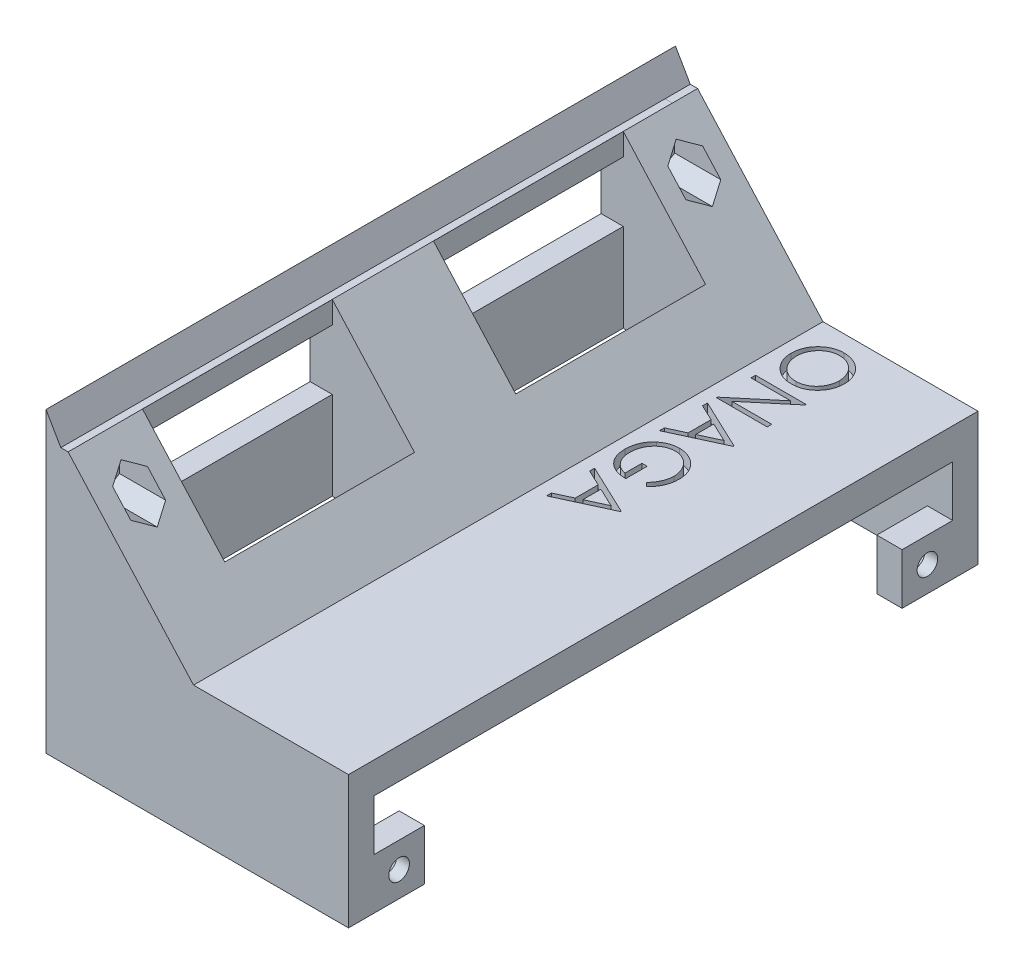
from build123d import *

# Parameters (mm, degrees)
SALIENTE_EXTRUIR3_DEPTH  = 4
SALIENTE_EXTRUIR5_DEPTH  = 91.5
SALIENTE_EXTRUIR6_DEPTH  = 4
SALIENTE_EXTRUIR7_DEPTH  = 7.75
SALIENTE_EXTRUIR8_DEPTH  = 7.75
SALIENTE_EXTRUIR9_DEPTH  = 76
CROQUIS9_W               = 16
CROQUIS9_H               = 11.933903627
SALIENTE_EXTRUIR10_DEPTH = 13
CROQUIS12_W              = 13
CROQUIS12_H              = 16
SALIENTE_EXTRUIR12_DEPTH = 15.007372
CORTAR_EXTRUIR2_START    = 30
CORTAR_EXTRUIR2_DEPTH    = 16
CORTAR_EXTRUIR3_DEPTH    = 22
CORTAR_EXTRUIR4_DEPTH    = 12
CORTAR_EXTRUIR5_DEPTH    = 12
CROQUIS19_R              = 1.625
SALIENTE_EXTRUIR13_DEPTH = 3
CROQUIS20_W              = 30
CROQUIS20_H              = 9.5
CORTAR_EXTRUIR6_DEPTH    = 3.5
CROQUIS23_W              = 7.5
CROQUIS23_H              = 7.75
CROQUIS23_W_2            = 7.2
CROQUIS23_H_2            = 16
SALIENTE_EXTRUIR14_DEPTH = 6.575989
CORTAR_EXTRUIR7_DEPTH    = 7.2
CROQUIS25_R              = 1.6
CORTAR_EXTRUIR8_DEPTH    = 3
CROQUIS28_W              = 8
CROQUIS28_H              = 8
CROQUIS28_R              = 1.625
SALIENTE_EXTRUIR15_DEPTH = 3
CORTAR_EXTRUIR9_DEPTH    = 2
CORTAR_EXTRUIR10_START   = -3
CORTAR_EXTRUIR10_DEPTH   = 3
CORTAR_EXTRUIR11_DEPTH   = 2
SALIENTE_EXTRUIR17_START = -4
CROQUIS33_W              = 8
CROQUIS33_H              = 8.032777932
CROQUIS33_R              = 1.625
SALIENTE_EXTRUIR17_DEPTH = 4
CORTAR_EXTRUIR12_DEPTH   = 2
CROQUIS35_W              = 8
CROQUIS35_H              = 10.1
CROQUIS35_H_2            = 10.114110211
CORTAR_EXTRUIR13_DEPTH   = 2


with BuildPart() as part:
    # Croquis1 → Saliente-Extruir3 (new body)
    with BuildSketch(Plane.XY):
        Polygon((2, 89.065555864), (2, 42), (49.818734343, 42), (49.818734343, 57.993901803), (49.818734343, 62.993901803), (25.316882713, 62.993901803), (5.497094433, 85.006831044), (4.341572012, 85.006831044), align=None)
    extrude(amount=-SALIENTE_EXTRUIR3_DEPTH)

    # Croquis4 → Saliente-Extruir5 (add)
    with BuildSketch(Plane(origin=(0, 0, -4), x_dir=(-1, 0, 0), z_dir=(0, 0, -1))):
        Polygon((-5.497094433, 85.006831044), (-4.341572012, 85.006831044), (-2, 89.065555864), (-2, 58.065555864), (-5.5, 58.065555864), (-5.5, 85.003603965), align=None)
    extrude(amount=SALIENTE_EXTRUIR5_DEPTH)

    # Croquis5 → Saliente-Extruir6 (add)
    with BuildSketch(Plane(origin=(0, 0, -95.5), x_dir=(-1, 0, 0), z_dir=(0, 0, -1))):
        Polygon((-49.818734343, 42), (-49.818734343, 62.993901803), (-25.316882713, 62.993901803), (-5.5, 85.003603965), (-4.341572012, 85.006831044), (-2, 89.065555864), (-2, 42), align=None)
    extrude(amount=SALIENTE_EXTRUIR6_DEPTH)

    # Croquis6 → Saliente-Extruir7 (add)
    with BuildSketch(Plane(origin=(0, 0, -4), x_dir=(-1, 0, 0), z_dir=(0, 0, -1))):
        Polygon((-5.5, 85.003603965), (-25.316882713, 62.993901803), (-49.818734343, 62.993901803), (-49.818734343, 58.065555864), (-5.5, 58.065555864), align=None)
    extrude(amount=SALIENTE_EXTRUIR7_DEPTH)

    # Croquis7 → Saliente-Extruir8 (add)
    with BuildSketch(Plane.XY.offset(-95.5)):
        Polygon((5.497094433, 85.006831044), (25.316882713, 62.993901803), (49.818734343, 62.993901803), (49.818734343, 58.065555864), (5.5, 58.065555864), align=None)
    extrude(amount=SALIENTE_EXTRUIR8_DEPTH)

    # Croquis8 → Saliente-Extruir9 (add)
    with BuildSketch(Plane.XY.offset(-87.75)):
        Polygon((18.5, 58.065555864), (18.5, 70.565100581), (25.316882713, 62.993901803), (49.818734343, 62.993901803), (49.818734343, 58.065555864), align=None)
    extrude(amount=SALIENTE_EXTRUIR9_DEPTH)

    # Croquis9 → Saliente-Extruir10 (add)
    with BuildSketch(Plane.ZY.offset(-18.5)):
        with Locations((-49.75, 64.032507678)):
            Rectangle(CROQUIS9_W, CROQUIS9_H)
    extrude(amount=SALIENTE_EXTRUIR10_DEPTH)

    # Croquis12 → Saliente-Extruir12 (add)
    with BuildSketch(Plane(origin=(0, 69.999459491, 0), x_dir=(1, 0, 0), z_dir=(0, 1, 0))):
        with Locations((12, 49.75)):
            Rectangle(CROQUIS12_W, CROQUIS12_H)
    extrude(amount=SALIENTE_EXTRUIR12_DEPTH)

    # Croquis13 → Cortar-Extruir2 (cut)
    with BuildSketch(Plane.XY.offset(-87.75).offset(CORTAR_EXTRUIR2_START)):
        Polygon((5.497094433, 85.006831044), (18.5, 70.565100581), (18.5, 85.006831044), align=None)
    extrude(amount=CORTAR_EXTRUIR2_DEPTH, mode=Mode.SUBTRACT)

    # Croquis14 → Cortar-Extruir3 (cut)
    with BuildSketch(Plane.XZ.offset(-58.065555864)):
        Polygon((2, -49.75), (2, -43.75), (8, -43.75), (8, -55.75), (2, -55.75), align=None)
    extrude(amount=-CORTAR_EXTRUIR3_DEPTH, mode=Mode.SUBTRACT)

    # Croquis15 → Cortar-Extruir4 (cut)
    with BuildSketch(Plane(origin=(0, 0, -43.75), x_dir=(-1, 0, 0), z_dir=(0, 0, -1))):
        Polygon((-8, 80.065555864), (-2, 80.065555864), (-2, 86.714478443), align=None)
    extrude(amount=CORTAR_EXTRUIR4_DEPTH, mode=Mode.SUBTRACT)

    # Croquis18 → Cortar-Extruir5 (cut)
    with BuildSketch(Plane.ZY.offset(-2)):
        Polygon((-93.625, 75.885555864), (-90.871039216, 77.475555864), (-90.871039216, 80.655555864), (-93.625, 82.245555864), (-96.378960784, 80.655555864), (-96.378960784, 77.475555864), align=None)
        Polygon((-5.875, 82.245555864), (-8.628960784, 80.655555864), (-8.628960784, 77.475555864), (-5.875, 75.885555864), (-3.121039216, 77.475555864), (-3.121039216, 80.655555864), align=None)
    extrude(amount=-CORTAR_EXTRUIR5_DEPTH, mode=Mode.SUBTRACT)

    # Croquis19 → Saliente-Extruir13 (add)
    # profile 1 of 2: a face of its own
    with BuildSketch(Plane.ZY.offset(-2)):
        Polygon((-93.625, 75.885555864), (-90.871039216, 77.475555864), (-90.871039216, 80.655555864), (-93.625, 82.245555864), (-96.378960784, 80.655555864), (-96.378960784, 77.475555864), align=None)
        with Locations((-93.625, 79.065555864)):
            Circle(CROQUIS19_R, mode=Mode.SUBTRACT)
    # profile 2 of 2: a face of its own
    with BuildSketch(Plane.ZY.offset(-2)):
        Polygon((-5.875, 75.885555864), (-3.121039216, 77.475555864), (-3.121039216, 80.655555864), (-5.875, 82.245555864), (-8.628960784, 80.655555864), (-8.628960784, 77.475555864), align=None)
        with Locations((-5.875, 79.065555864)):
            Circle(CROQUIS19_R, mode=Mode.SUBTRACT)
    extrude(amount=-SALIENTE_EXTRUIR13_DEPTH)

    # Croquis20 → Cortar-Extruir6 (cut)
    with BuildSketch(Plane(origin=(5.5, 0, 0), x_dir=(0, 0, -1), z_dir=(1, 0, 0))):
        with Locations((72.75, 76.753603965)):
            Rectangle(CROQUIS20_W, CROQUIS20_H)
        with Locations((26.75, 76.753603965)):
            Rectangle(CROQUIS20_W, CROQUIS20_H)
    extrude(amount=-CORTAR_EXTRUIR6_DEPTH, mode=Mode.SUBTRACT)

    # Croquis23 → Saliente-Extruir14 (add)
    with BuildSketch(Plane.XZ.offset(-58.065555864)):
        with Locations((11.45, -7.875)):
            Rectangle(CROQUIS23_W, CROQUIS23_H)
        with Locations((11.6, -49.75)):
            Rectangle(CROQUIS23_W_2, CROQUIS23_H_2)
        with Locations((11.45, -91.625)):
            Rectangle(CROQUIS23_W, CROQUIS23_H)
    extrude(amount=SALIENTE_EXTRUIR14_DEPTH)

    # Croquis24 → Cortar-Extruir7 (cut)
    with BuildSketch(Plane(origin=(15.2, 0, 0), x_dir=(0, 0, -1), z_dir=(1, 0, 0))):
        Polygon((8.979427919, 52.468994288), (8, 51.489566369), (11.75, 51.489566369), (11.75, 55.239566369), align=None)
        Polygon((41.75, 51.489566369), (41.75, 54.739566369), (45, 51.489566369), align=None)
        Polygon((56.18727418, 53.176840549), (54.5, 51.489566369), (57.75, 51.489566369), (57.75, 54.739566369), align=None)
        Polygon((89.03136291, 53.958203459), (91.5, 51.489566369), (87.75, 51.489566369), (87.75, 55.239566369), align=None)
    extrude(amount=-CORTAR_EXTRUIR7_DEPTH, mode=Mode.SUBTRACT)

    # Croquis25 → Cortar-Extruir8 (cut)
    with BuildSketch(Plane.XZ.offset(-51.489566369)):
        with Locations(Location((11.45, -54.5, 0), (0, 0, 270))):
            Circle(CROQUIS25_R)
        with Locations(Location((11.45, -45, 0), (0, 0, 270))):
            Circle(CROQUIS25_R)
        with Locations(Location((11.45, -8, 0), (0, 0, 270))):
            Circle(CROQUIS25_R)
        with Locations(Location((11.45, -91.5, 0), (0, 0, 270))):
            Circle(CROQUIS25_R)
    extrude(amount=-CORTAR_EXTRUIR8_DEPTH, mode=Mode.SUBTRACT)

    # Croquis28 → Saliente-Extruir15 (add)
    # profile 1 of 2: a face of its own
    with BuildSketch(Plane.ZY.offset(-2)):
        with Locations((-91.5, 46)):
            Rectangle(CROQUIS28_W, CROQUIS28_H)
        with Locations((-91.5, 46)):
            Circle(CROQUIS28_R, mode=Mode.SUBTRACT)
    # profile 2 of 2: a face of its own
    with BuildSketch(Plane.ZY.offset(-2)):
        with Locations((-8, 46)):
            Rectangle(CROQUIS28_W, CROQUIS28_H)
        with Locations((-8, 46)):
            Circle(CROQUIS28_R, mode=Mode.SUBTRACT)
    extrude(amount=-SALIENTE_EXTRUIR15_DEPTH)

    # Croquis29 → Cortar-Extruir9 (cut)
    with BuildSketch(Plane(origin=(5, 0, 0), x_dir=(0, 0, -1), z_dir=(1, 0, 0))):
        Polygon((11.17, 46), (9.585, 48.74530053), (6.415, 48.74530053), (4.83, 46), (6.415, 43.25469947), (9.585, 43.25469947), align=None)
        Polygon((94.68, 46), (93.09, 48.753960784), (89.91, 48.753960784), (88.32, 46), (89.91, 43.246039216), (93.09, 43.246039216), align=None)
    extrude(amount=-CORTAR_EXTRUIR9_DEPTH, mode=Mode.SUBTRACT)

    # Croquis30 → Cortar-Extruir10 (cut)
    with BuildSketch(Plane(origin=(5, 0, 0), x_dir=(0, 0, -1), z_dir=(1, 0, 0)).offset(CORTAR_EXTRUIR10_START)):
        Polygon((12, 50), (12, 49), (11, 50), align=None)
        Polygon((87.5, 50), (87.5, 49), (88.5, 50), align=None)
    extrude(amount=CORTAR_EXTRUIR10_DEPTH, mode=Mode.SUBTRACT)

    # Croquis31 → Cortar-Extruir11 (cut)
    # profile 1 of 5: a face of its own
    with BuildSketch(Plane(origin=(0, 62.993901803, 0), x_dir=(1, 0, 0), z_dir=(0, 1, 0))):
        with BuildLine():
            add(Edge.make_bspline(
                [(35.522010918, 92.730769231), (35.518258931, 92.582636447), (35.510889719, 92.291691438), (35.454480825, 91.864091249), (35.356889582, 91.455875439), (35.226923544, 91.063709462), (35.053518109, 90.692317849), (34.844041957, 90.338779161), (34.595515846, 90.004092985), (34.312109928, 89.691327124), (34.00262871, 89.406167399), (33.671404365, 89.157025312), (33.322972491, 88.946377559), (32.95612064, 88.773724366), (32.572463455, 88.638153823), (32.169819533, 88.544632996), (31.750834508, 88.484886354), (31.465058584, 88.477902036), (31.320087841, 88.474358974)],
                knots=[0, 0, 0, 0, 1.06508495, 2.091914715, 3.094501328, 4.079693967, 5.057647778, 6.035986298, 7.030177474, 8.050107388, 9.066943579, 10.051896531, 11.025616101, 11.9896488, 12.96281505, 13.945825876, 14.957941789, 16, 16, 16, 16], degree=3))
            add(Edge.make_bspline(
                [(31.320087841, 88.474358974), (31.176184982, 88.477901511), (30.892535777, 88.48488426), (30.476209684, 88.544700996), (30.075995845, 88.638500231), (29.692601226, 88.772466778), (29.325477225, 88.944290545), (28.976404899, 89.156361969), (28.642887123, 89.403854575), (28.331903515, 89.688028671), (28.046183597, 89.997436085), (27.79665416, 90.32959446), (27.583412832, 90.677683424), (27.411943853, 91.044313507), (27.275413843, 91.42539739), (27.182240104, 91.824427692), (27.12216221, 92.239623905), (27.115261811, 92.522757064), (27.111754508, 92.666666667)],
                knots=[0, 0, 0, 0, 1.04355943, 2.056976533, 3.044937463, 4.02179873, 4.997890911, 5.980248884, 6.980147982, 8.006253959, 9.032111064, 10.031228745, 11.015595249, 11.988180414, 12.962670953, 13.946861971, 14.95644057, 16, 16, 16, 16], degree=3))
            add(Edge.make_bspline(
                [(27.111754508, 92.666666667), (27.115295488, 92.811636822), (27.122275703, 93.097411589), (27.182125729, 93.516920748), (27.275680862, 93.919856211), (27.409508134, 94.304977344), (27.581813056, 94.67241053), (27.793550217, 95.022120231), (28.043053381, 95.354526679), (28.326849135, 95.666247253), (28.636405248, 95.951117719), (28.96638033, 96.201677743), (29.313636128, 96.412194194), (29.67674119, 96.584571853), (30.054756951, 96.720916019), (30.450061271, 96.81396422), (30.860439044, 96.874158344), (31.139851141, 96.881095457), (31.281626303, 96.884615385)],
                knots=[0, 0, 0, 0, 1.053167129, 2.076072758, 3.073341244, 4.055601477, 5.033424535, 6.017524495, 7.021518915, 8.049444456, 9.077120685, 10.074910483, 11.055688766, 12.022980584, 12.991883888, 13.970269434, 14.970104079, 16, 16, 16, 16], degree=3))
            add(Edge.make_bspline(
                [(31.281626303, 96.884615385), (31.376787124, 96.883394481), (31.565908271, 96.880968077), (31.846739815, 96.851713435), (32.123085302, 96.809348482), (32.394015792, 96.74831527), (32.659575527, 96.669587604), (32.919221423, 96.572569112), (33.1750922, 96.461385882), (33.422318182, 96.329006889), (33.661287408, 96.184577446), (33.889011767, 96.02709165), (34.101423487, 95.855451436), (34.301935684, 95.672108645), (34.48712607, 95.474525401), (34.661032222, 95.265675327), (34.821853929, 95.044465623), (34.96621349, 94.810546442), (35.098809501, 94.569881641), (35.209516259, 94.320725186), (35.307366186, 94.068334027), (35.385127862, 93.810485004), (35.447011067, 93.547774564), (35.489059141, 93.279874291), (35.518378785, 93.007060118), (35.520794998, 92.823262439), (35.522010918, 92.730769231)],
                knots=[0, 0, 0, 0, 1.037115869, 2.061148057, 3.07517727, 4.084041727, 5.086514338, 6.092668487, 7.104487461, 8.125783165, 9.147610153, 10.147694368, 11.141876323, 12.122903372, 13.107606018, 14.091946891, 15.084523921, 16.086505767, 17.087268121, 18.077809654, 19.05670789, 20.036870126, 21.011670792, 21.99694167, 22.991993299, 24, 24, 24, 24], degree=3))
        make_face()
        with BuildLine():
            add(Edge.make_bspline(
                [(34.701498098, 92.695512821), (34.700573075, 92.771432156), (34.698731872, 92.922545034), (34.674460866, 93.14719284), (34.639902789, 93.368898336), (34.59048209, 93.587649457), (34.52376594, 93.80226902), (34.445155188, 94.014900292), (34.352681552, 94.224522292), (34.24485499, 94.428791596), (34.127066181, 94.627366767), (33.99778888, 94.816029701), (33.857649947, 94.992898358), (33.708500522, 95.158539312), (33.548823069, 95.312469888), (33.381166052, 95.457810362), (33.200703051, 95.588711181), (33.012336822, 95.708678506), (32.816310239, 95.816033491), (32.614687727, 95.91149718), (32.405824435, 95.989586337), (32.191986362, 96.05327177), (31.973512168, 96.106071338), (31.748744514, 96.139520307), (31.518812829, 96.164051414), (31.363425734, 96.165788204), (31.284831431, 96.166666667)],
                knots=[0, 0, 0, 0, 1.008585988, 2.007529826, 2.999688727, 3.990042337, 4.984966365, 5.984641633, 7.001812546, 8.027570247, 9.052811818, 10.068991095, 11.064725446, 12.050001529, 13.029093193, 14.010961114, 14.996492974, 15.989185205, 16.977398719, 17.96520407, 18.951579521, 19.937648295, 20.929603947, 21.935788061, 22.955928099, 24, 24, 24, 24], degree=3))
            add(Edge.make_bspline(
                [(31.284831431, 96.166666667), (31.16926064, 96.163752696), (30.941897143, 96.158020016), (30.608712814, 96.107831284), (30.288511016, 96.030523914), (29.983043795, 95.916564219), (29.689685434, 95.774048528), (29.411038338, 95.597987065), (29.147027197, 95.389394869), (28.899495153, 95.152449666), (28.673561886, 94.893426336), (28.475245524, 94.618380096), (28.307450667, 94.330257565), (28.170753359, 94.028307387), (28.062433958, 93.714141584), (27.988197087, 93.385735753), (27.939338903, 93.04527756), (27.93464689, 92.813207491), (27.932267328, 92.695512821)],
                knots=[0, 0, 0, 0, 1.032063989, 2.030389145, 3.003944642, 3.970395727, 4.937377036, 5.913328081, 6.909231446, 7.93887556, 8.970685674, 9.976071282, 10.964166581, 11.944589148, 12.933237628, 13.927779006, 14.949070134, 16, 16, 16, 16], degree=3))
            add(Edge.make_bspline(
                [(27.932267328, 92.695512821), (27.933354192, 92.616405386), (27.93550977, 92.459511584), (27.957221078, 92.226150423), (27.992036603, 91.996993244), (28.042164467, 91.772362205), (28.104898531, 91.552509512), (28.179439448, 91.336527704), (28.272391289, 91.126679266), (28.375256838, 90.920460748), (28.491680754, 90.723032691), (28.619151016, 90.535721438), (28.756783719, 90.359612909), (28.904637951, 90.194325663), (29.06143917, 90.039328521), (29.231218993, 89.898830304), (29.40901907, 89.766361315), (29.597824664, 89.646874353), (29.79426433, 89.539732807), (29.996650563, 89.44656659), (30.204287831, 89.367478272), (30.417528051, 89.303644782), (30.635952216, 89.253620035), (30.859856566, 89.219151873), (31.08879216, 89.195041095), (31.243635265, 89.193223784), (31.321690405, 89.192307692)],
                knots=[0, 0, 0, 0, 1.047226202, 2.076964084, 3.100341814, 4.114585567, 5.122123135, 6.126552355, 7.137064942, 8.158803602, 9.176592812, 10.169297945, 11.156925011, 12.133779169, 13.104132798, 14.073170763, 15.049307625, 16.038276215, 17.028988595, 18.010110019, 18.986169996, 19.968539974, 20.955178716, 21.950601663, 22.966915103, 24, 24, 24, 24], degree=3))
            add(Edge.make_bspline(
                [(31.321690405, 89.192307692), (31.399211558, 89.193224522), (31.552989044, 89.195043222), (31.780328057, 89.219140307), (32.002621112, 89.253656628), (32.218995519, 89.303399961), (32.429506433, 89.367514598), (32.633956142, 89.446571353), (32.833106303, 89.539794895), (33.026464696, 89.646785122), (33.212006954, 89.767049861), (33.389383896, 89.898465275), (33.555264453, 90.043300355), (33.713743732, 90.197416989), (33.861441848, 90.364664703), (33.998407294, 90.544286038), (34.127947411, 90.734099813), (34.244801223, 90.935077672), (34.352736749, 91.142487478), (34.445132543, 91.355337596), (34.524105919, 91.571589651), (34.590209008, 91.790136444), (34.639951207, 92.012517547), (34.674448467, 92.237437942), (34.698734471, 92.465282076), (34.700573965, 92.618525706), (34.701498098, 92.695512821)],
                knots=[0, 0, 0, 0, 1.029967493, 2.04313025, 3.035375922, 4.01889446, 4.991458755, 5.958017022, 6.930036849, 7.912118993, 8.892942568, 9.867138445, 10.843712051, 11.817804417, 12.803729339, 13.806387533, 14.818654169, 15.856205545, 16.894655496, 17.924916651, 18.938004761, 19.953404357, 20.957695443, 21.963967554, 22.97713031, 24, 24, 24, 24], degree=3))
        make_face(mode=Mode.SUBTRACT)
    # profile 2 of 5: a face of its own
    with BuildSketch(Plane(origin=(0, 62.993901803, 0), x_dir=(1, 0, 0), z_dir=(0, 1, 0))):
        Polygon((27.316882713, 86.833333333), (35.316882713, 86.833333333), (35.316882713, 86.682692308), (29.020408354, 81.397435897), (35.316882713, 81.397435897), (35.316882713, 80.679487179), (27.316882713, 80.679487179), (27.316882713, 80.842948718), (33.598933995, 86.115384615), (27.316882713, 86.115384615), align=None)
    # profile 3 of 5: a face of its own
    with BuildSketch(Plane(origin=(0, 62.993901803, 0), x_dir=(1, 0, 0), z_dir=(0, 1, 0))):
        Polygon((35.316882713, 75.346153846), (27.316882713, 71.653846154), (27.316882713, 72.434294872), (29.880985277, 73.616987179), (29.880985277, 77.243589744), (27.316882713, 78.459935897), (27.316882713, 79.243589744), (35.316882713, 75.448717949), align=None)
        Polygon((33.757587841, 75.405448718), (30.701498098, 76.854166667), (30.701498098, 73.995192308), align=None, mode=Mode.SUBTRACT)
    # profile 4 of 5: a face of its own
    with BuildSketch(Plane(origin=(0, 62.993901803, 0), x_dir=(1, 0, 0), z_dir=(0, 1, 0))):
        with BuildLine():
            Line((33.951498098, 62.935897436), (33.368164764, 63.551282051))
            add(Edge.make_bspline(
                [(33.368164764, 63.551282051), (33.472741955, 63.66331396), (33.678847459, 63.884111564), (33.949676934, 64.241749796), (34.17761011, 64.616900006), (34.366295338, 65.003982375), (34.515482261, 65.396086931), (34.621125317, 65.786924462), (34.689545223, 66.172275248), (34.697547052, 66.428146278), (34.701498098, 66.554487179)],
                knots=[0, 0, 0, 0, 1.09204548, 2.152253107, 3.191356492, 4.216655925, 5.218178745, 6.177092199, 7.099906635, 8, 8, 8, 8], degree=3))
            add(Edge.make_bspline(
                [(34.701498098, 66.554487179), (34.700551316, 66.632006059), (34.69866021, 66.786842768), (34.674579925, 67.016842258), (34.639839375, 67.244398834), (34.590090578, 67.468727772), (34.525475301, 67.690720975), (34.447462, 67.90988461), (34.35355059, 68.12579563), (34.246483124, 68.337318405), (34.129600861, 68.543427397), (33.99924439, 68.737276422), (33.859416796, 68.91966248), (33.70831517, 69.089337429), (33.548341029, 69.248471441), (33.377317683, 69.394996916), (33.196486471, 69.529648789), (33.005864093, 69.650875395), (32.809783763, 69.75911537), (32.610034041, 69.854857641), (32.406823117, 69.934446175), (32.201328015, 70.000492582), (31.993120279, 70.052235265), (31.78219446, 70.089253789), (31.567830587, 70.109976412), (31.424295995, 70.113575369), (31.352139123, 70.115384615)],
                knots=[0, 0, 0, 0, 1.028345126, 2.054023193, 3.065714254, 4.082262095, 5.100859654, 6.132352297, 7.167492809, 8.223256921, 9.277568108, 10.309840045, 11.320860232, 12.32524711, 13.322830633, 14.313234294, 15.3114222, 16.312425732, 17.308799391, 18.282312954, 19.249923241, 20.202773571, 21.145015718, 22.094907699, 23.042283124, 24, 24, 24, 24], degree=3))
            add(Edge.make_bspline(
                [(31.352139123, 70.115384615), (31.278381374, 70.113641867), (31.131067282, 70.11016113), (30.911133618, 70.08831025), (30.694888037, 70.046485865), (30.479924798, 69.994964628), (30.269028776, 69.923207847), (30.059838333, 69.838602984), (29.854267258, 69.737182759), (29.653566211, 69.620137134), (29.458090643, 69.491693516), (29.273953093, 69.347828418), (29.098710574, 69.195002947), (28.936251578, 69.027657232), (28.782231273, 68.851155329), (28.640892929, 68.660224437), (28.509514135, 68.458618806), (28.389750662, 68.246030895), (28.282759723, 68.024767392), (28.187619389, 67.797894814), (28.109266618, 67.564688378), (28.045408095, 67.326373659), (27.993064558, 67.083234752), (27.959390317, 66.834037489), (27.934954133, 66.580614155), (27.933167458, 66.409782996), (27.932267328, 66.323717949)],
                knots=[0, 0, 0, 0, 0.935842715, 1.869129955, 2.799583258, 3.728257868, 4.6712142, 5.62263184, 6.589468525, 7.576334199, 8.568768874, 9.554260682, 10.538610026, 11.516240982, 12.510802173, 13.508383516, 14.52719334, 15.561971611, 16.601598616, 17.64369662, 18.68095744, 19.719943675, 20.77263142, 21.833597991, 22.908562741, 24, 24, 24, 24], degree=3))
            add(Edge.make_bspline(
                [(27.932267328, 66.323717949), (27.934435502, 66.219996012), (27.938693065, 66.016321137), (27.971836587, 65.71692356), (28.023600673, 65.429373662), (28.099408486, 65.154479562), (28.196102421, 64.891921513), (28.312663966, 64.640738707), (28.453559925, 64.402902397), (28.612595115, 64.17772134), (28.789738145, 63.970222245), (28.981046875, 63.783321823), (29.184649549, 63.619039584), (29.402344509, 63.478742076), (29.630650651, 63.357876688), (29.873633658, 63.261491819), (30.12853864, 63.186935415), (30.304762627, 63.156436337), (30.39380579, 63.141025641)],
                knots=[0, 0, 0, 0, 1.13011591, 2.219166196, 3.278784489, 4.311187005, 5.322345388, 6.325022048, 7.324448642, 8.33076908, 9.325913853, 10.293360401, 11.241630175, 12.171712957, 13.111744789, 14.052245185, 15.015830637, 16, 16, 16, 16], degree=3))
            Line((30.39380579, 63.141025641), (30.39380579, 65.807692308))
            Line((30.39380579, 65.807692308), (31.21431861, 65.807692308))
            Line((31.21431861, 65.807692308), (31.21431861, 62.423076923))
            add(Edge.make_bspline(
                [(31.21431861, 62.423076923), (31.061387207, 62.426976005), (30.762072826, 62.434607213), (30.32556935, 62.488136163), (29.913291194, 62.574573905), (29.524804173, 62.692654618), (29.160658818, 62.845512402), (28.82048541, 63.031506752), (28.506481568, 63.253614458), (28.216083845, 63.503924038), (27.957045646, 63.784838228), (27.729374931, 64.088766502), (27.537597524, 64.416211001), (27.381573153, 64.766861989), (27.259804022, 65.139571552), (27.173468989, 65.535202134), (27.121743359, 65.953217221), (27.115134492, 66.239701054), (27.111754508, 66.386217949)],
                knots=[0, 0, 0, 0, 1.140356446, 2.231883559, 3.274166699, 4.278491846, 5.25512956, 6.21435461, 7.1637429, 8.11826594, 9.068280886, 10.0076534, 10.945064095, 11.891975133, 12.864533718, 13.863980011, 14.907571808, 16, 16, 16, 16], degree=3))
            add(Edge.make_bspline(
                [(27.111754508, 66.386217949), (27.113055356, 66.47652683), (27.115621049, 66.654645049), (27.133854986, 66.917710027), (27.161924875, 67.173521731), (27.204313728, 67.422042894), (27.256232938, 67.664187677), (27.322716866, 67.898746728), (27.399673893, 68.126613567), (27.487206861, 68.348140391), (27.588627791, 68.561316498), (27.701335538, 68.767091394), (27.824748934, 68.966602539), (27.961002296, 69.158490916), (28.109076491, 69.343756336), (28.269268305, 69.521204207), (28.441088008, 69.691827929), (28.563097172, 69.798708988), (28.624575021, 69.852564103)],
                knots=[0, 0, 0, 0, 1.107784379, 2.184907829, 3.233506516, 4.263428166, 5.276301166, 6.270063455, 7.25232949, 8.225834625, 9.190232166, 10.146266622, 11.1027726, 12.066435141, 13.031522626, 14.010570082, 14.99756817, 16, 16, 16, 16], degree=3))
            add(Edge.make_bspline(
                [(28.624575021, 69.852564103), (28.722107942, 69.930703376), (28.915554838, 70.08568489), (29.225497568, 70.28517782), (29.546416106, 70.455238169), (29.879203828, 70.593221762), (30.223549457, 70.70096596), (30.57901298, 70.778237395), (30.946052135, 70.823511198), (31.194429883, 70.83003357), (31.320087841, 70.833333333)],
                knots=[0, 0, 0, 0, 1.023165419, 2.029347347, 3.013907458, 3.994755782, 4.975994455, 5.96558838, 6.970761222, 8, 8, 8, 8], degree=3))
            add(Edge.make_bspline(
                [(31.320087841, 70.833333333), (31.414181144, 70.832113493), (31.60117188, 70.829689315), (31.878803139, 70.800422343), (32.151435985, 70.758180556), (32.419322925, 70.69699502), (32.681274381, 70.616489947), (32.939304219, 70.519807343), (33.192377157, 70.40656116), (33.438265063, 70.27441967), (33.676827947, 70.130538713), (33.9007621, 69.96891906), (34.113941778, 69.797519034), (34.3125055, 69.611492669), (34.497317969, 69.411893804), (34.669063948, 69.199827645), (34.828182397, 68.975397823), (34.972110877, 68.73782612), (35.101399849, 68.490678019), (35.214746433, 68.234540634), (35.308422633, 67.969493588), (35.387905544, 67.697522193), (35.446683012, 67.41656791), (35.489308714, 67.128669539), (35.5184758, 66.832326426), (35.520821527, 66.632015502), (35.522010918, 66.530448718)],
                knots=[0, 0, 0, 0, 1.009014138, 2.005204323, 2.991638015, 3.967544938, 4.950092358, 5.929358695, 6.922031709, 7.921874511, 8.922406847, 9.908357674, 10.882125353, 11.855201406, 12.82437151, 13.798139189, 14.780770167, 15.773426639, 16.775664355, 17.771244468, 18.775446331, 19.789330884, 20.808771541, 21.851841802, 22.910785716, 24, 24, 24, 24], degree=3))
            add(Edge.make_bspline(
                [(35.522010918, 66.530448718), (35.520689676, 66.447617841), (35.518069808, 66.283373945), (35.499816453, 66.038981138), (35.471205696, 65.798847008), (35.431198343, 65.561766948), (35.378275102, 65.32864366), (35.313776985, 65.098770854), (35.239100629, 64.872583297), (35.149970419, 64.650350075), (35.04882278, 64.430560252), (34.934962565, 64.211996254), (34.806448536, 63.995403634), (34.662897523, 63.780407121), (34.506775446, 63.56565087), (34.333616986, 63.354531689), (34.150250689, 63.14195353), (34.018405697, 63.005263669), (33.951498098, 62.935897436)],
                knots=[0, 0, 0, 0, 0.985875312, 1.954874891, 2.915472732, 3.863573565, 4.815313299, 5.759461513, 6.704487138, 7.649063459, 8.607849844, 9.583336382, 10.581114205, 11.603942397, 12.659508253, 13.739925933, 14.853076422, 16, 16, 16, 16], degree=3))
        make_face()
    # profile 5 of 5: a face of its own
    with BuildSketch(Plane(origin=(0, 62.993901803, 0), x_dir=(1, 0, 0), z_dir=(0, 1, 0))):
        Polygon((35.316882713, 57.5), (27.316882713, 53.807692308), (27.316882713, 54.588141026), (29.880985277, 55.770833333), (29.880985277, 59.397435897), (27.316882713, 60.613782051), (27.316882713, 61.397435897), (35.316882713, 57.602564103), align=None)
        Polygon((33.757587841, 57.559294872), (30.701498098, 59.008012821), (30.701498098, 56.149038462), align=None, mode=Mode.SUBTRACT)
    extrude(amount=-CORTAR_EXTRUIR11_DEPTH, mode=Mode.SUBTRACT)

    # Croquis33 → Saliente-Extruir17 (add)
    # profile 1 of 2: a face of its own
    with BuildSketch(Plane(origin=(49.818734343, 0, 0), x_dir=(0, 0, -1), z_dir=(1, 0, 0)).offset(SALIENTE_EXTRUIR17_START)):
        with Locations((8, 46.016388966)):
            Rectangle(CROQUIS33_W, CROQUIS33_H)
        with Locations(Location((8, 46, 0), (0, 0, 180))):
            Circle(CROQUIS33_R, mode=Mode.SUBTRACT)
    # profile 2 of 2: a face of its own
    with BuildSketch(Plane(origin=(49.818734343, 0, 0), x_dir=(0, 0, -1), z_dir=(1, 0, 0)).offset(SALIENTE_EXTRUIR17_START)):
        with Locations((91.5, 46.016388966)):
            Rectangle(CROQUIS33_W, CROQUIS33_H)
        with Locations(Location((91.5, 46, 0), (0, 0, 180))):
            Circle(CROQUIS33_R, mode=Mode.SUBTRACT)
    extrude(amount=SALIENTE_EXTRUIR17_DEPTH)

    # Croquis34 → Cortar-Extruir12 (cut)
    with BuildSketch(Plane.ZY.offset(-45.818734343)):
        Polygon((-88.33, 46), (-89.915, 48.74530053), (-93.085, 48.74530053), (-94.67, 46), (-93.085, 43.25469947), (-89.915, 43.25469947), align=None)
        Polygon((-11.17, 46), (-9.585, 43.25469947), (-6.415, 43.25469947), (-4.83, 46), (-6.415, 48.74530053), (-9.585, 48.74530053), align=None)
    extrude(amount=-CORTAR_EXTRUIR12_DEPTH, mode=Mode.SUBTRACT)

    # Croquis35 → Cortar-Extruir13 (cut)
    with BuildSketch(Plane.XZ.offset(-58.065555864)):
        with Locations((22.5, -26.5)):
            Rectangle(CROQUIS35_W, CROQUIS35_H)
        with Locations((22.5, -73.007055106)):
            Rectangle(CROQUIS35_W, CROQUIS35_H_2)
    extrude(amount=-CORTAR_EXTRUIR13_DEPTH, mode=Mode.SUBTRACT)


solid = part.part
